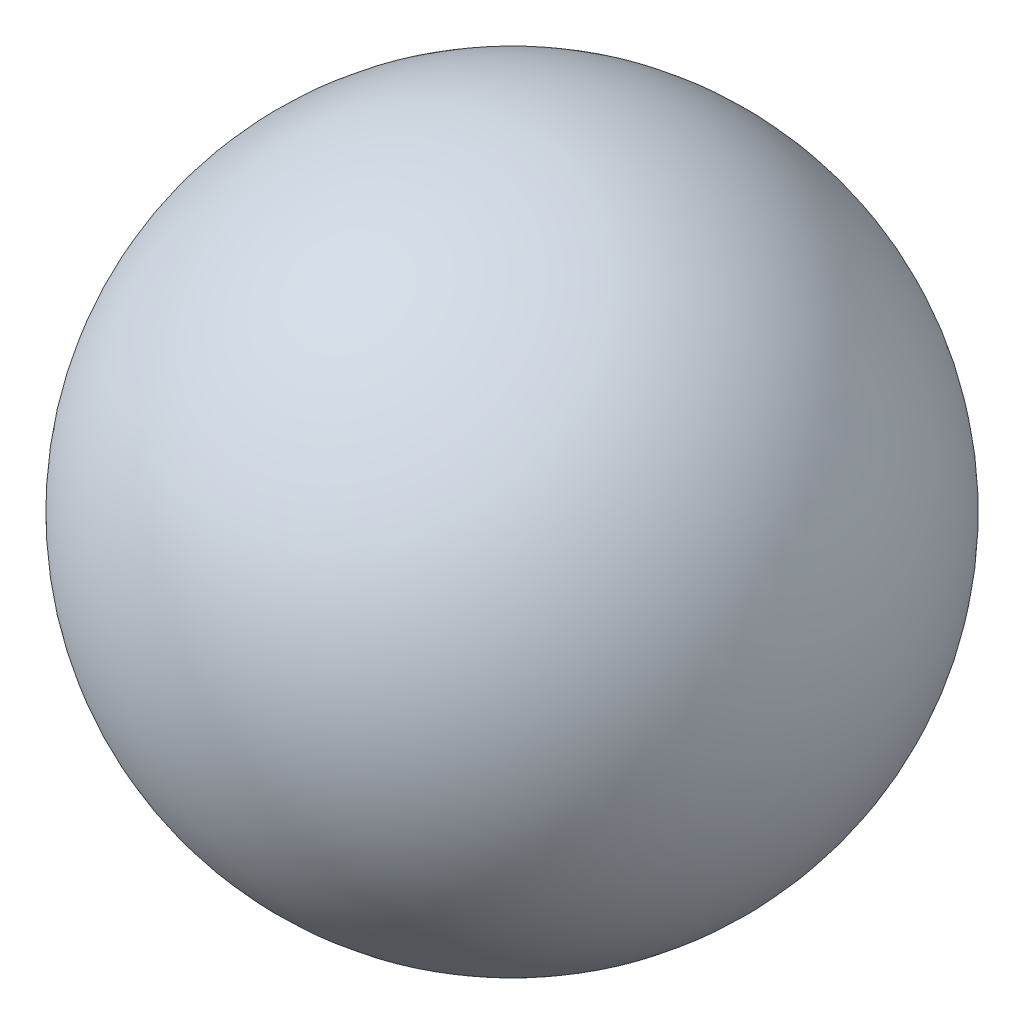
from build123d import *
from build123d.topology import SkipClean


with BuildPart() as part:
    # Sketch2 → Revolve4 (revolve)
    with SkipClean():  # the faces are left unmerged after this step: merging them gives an invalid solid
        with BuildSketch(Plane.XY):
            with BuildLine():
                ThreePointArc((88.9, 0), (62.861792847, 62.861792847), (0, 88.9))
                Line((0, 88.9), (0, -88.9))
                ThreePointArc((0, -88.9), (62.861792847, -62.861792847), (88.9, 0))
            make_face()
            with BuildLine():
                Line((0, -88.9), (0, 88.9))
                ThreePointArc((0, 88.9), (-88.9, 0), (0, -88.9))
            make_face()
        revolve(axis=Axis((0, 88.9, 0), (0, -1, 0)))


solid = part.part
